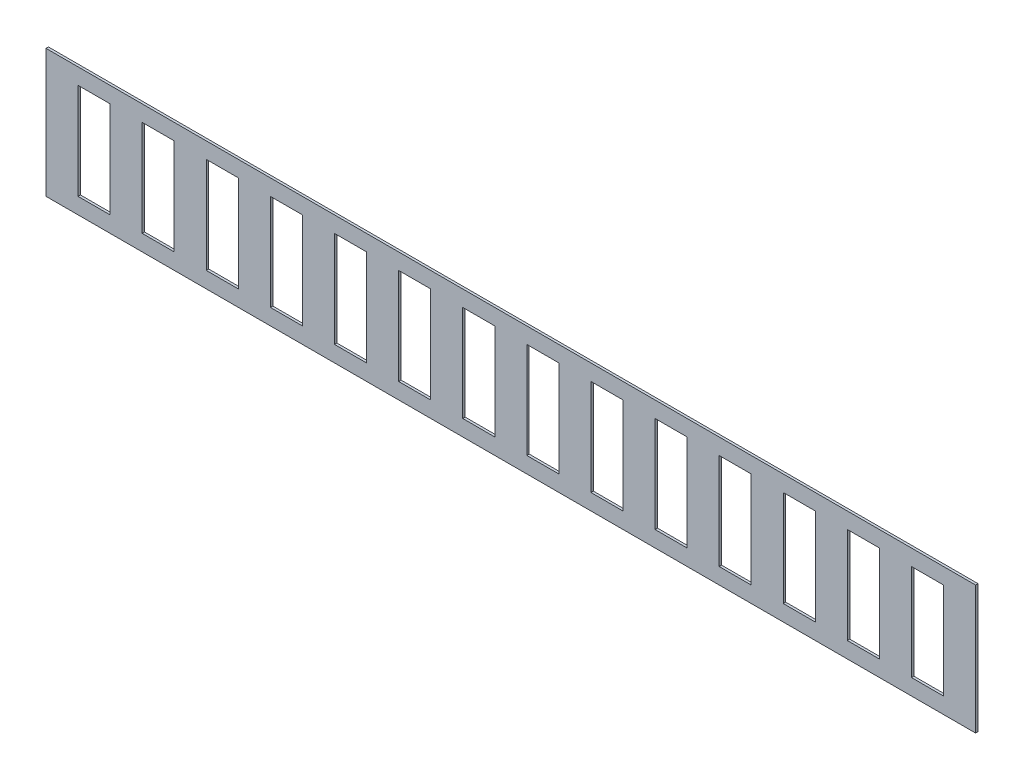
from build123d import *

# Parameters (mm, degrees)
PACK_PLINT_IZGARA_PANELI_1_START  = 18.5
SKETCH1_W                         = 580
SKETCH1_H                         = 80
PACK_PLINT_IZGARA_PANELI_1_DEPTH  = 1.5
PACK_PLINT_IZGARA_PANELI_2_START  = 17
SKETCH2_W                         = 20
SKETCH2_H                         = 60
PACK_PLINT_IZGARA_PANELI_2_DEPTH  = 4
PACK_PLINT_IZGARA_PANELI_3_START  = 17
SKETCH3_W                         = 20
SKETCH3_H                         = 60
PACK_PLINT_IZGARA_PANELI_3_DEPTH  = 4
PACK_PLINT_IZGARA_PANELI_4_START  = 17
SKETCH4_W                         = 20
SKETCH4_H                         = 60
PACK_PLINT_IZGARA_PANELI_4_DEPTH  = 4
PACK_PLINT_IZGARA_PANELI_5_START  = 17
SKETCH5_W                         = 20
SKETCH5_H                         = 60
PACK_PLINT_IZGARA_PANELI_5_DEPTH  = 4
PACK_PLINT_IZGARA_PANELI_6_START  = 17
SKETCH6_W                         = 20
SKETCH6_H                         = 60
PACK_PLINT_IZGARA_PANELI_6_DEPTH  = 4
PACK_PLINT_IZGARA_PANELI_7_START  = 17
SKETCH7_W                         = 20
SKETCH7_H                         = 60
PACK_PLINT_IZGARA_PANELI_7_DEPTH  = 4
PACK_PLINT_IZGARA_PANELI_8_START  = 17
SKETCH8_W                         = 20
SKETCH8_H                         = 60
PACK_PLINT_IZGARA_PANELI_8_DEPTH  = 4
PACK_PLINT_IZGARA_PANELI_9_START  = 17
SKETCH9_W                         = 20
SKETCH9_H                         = 60
PACK_PLINT_IZGARA_PANELI_9_DEPTH  = 4
PACK_PLINT_IZGARA_PANELI_10_START = 17
SKETCH10_W                        = 20
SKETCH10_H                        = 60
PACK_PLINT_IZGARA_PANELI_10_DEPTH = 4
PACK_PLINT_IZGARA_PANELI_11_START = 17
SKETCH11_W                        = 20
SKETCH11_H                        = 60
PACK_PLINT_IZGARA_PANELI_11_DEPTH = 4
PACK_PLINT_IZGARA_PANELI_12_START = 17
SKETCH12_W                        = 20
SKETCH12_H                        = 60
PACK_PLINT_IZGARA_PANELI_12_DEPTH = 4
PACK_PLINT_IZGARA_PANELI_13_START = 17
SKETCH13_W                        = 20
SKETCH13_H                        = 60
PACK_PLINT_IZGARA_PANELI_13_DEPTH = 4
PACK_PLINT_IZGARA_PANELI_14_START = 17
SKETCH14_W                        = 20
SKETCH14_H                        = 60
PACK_PLINT_IZGARA_PANELI_14_DEPTH = 4
PACK_PLINT_IZGARA_PANELI_15_START = 17
SKETCH15_W                        = 20
SKETCH15_H                        = 60
PACK_PLINT_IZGARA_PANELI_15_DEPTH = 4


with BuildPart() as part:
    # Sketch1 → PACK_plint_izgara_paneli_1 (new body)
    with BuildSketch(Plane.XY.offset(PACK_PLINT_IZGARA_PANELI_1_START)):
        with Locations((350, 70)):
            Rectangle(SKETCH1_W, SKETCH1_H)
    extrude(amount=PACK_PLINT_IZGARA_PANELI_1_DEPTH)

    # Sketch2 → PACK_plint_izgara_paneli_2 (cut)
    with BuildSketch(Plane.XY.offset(PACK_PLINT_IZGARA_PANELI_2_START)):
        with Locations((90, 70)):
            Rectangle(SKETCH2_W, SKETCH2_H)
    extrude(amount=PACK_PLINT_IZGARA_PANELI_2_DEPTH, mode=Mode.SUBTRACT)

    # Sketch3 → PACK_plint_izgara_paneli_3 (cut)
    with BuildSketch(Plane.XY.offset(PACK_PLINT_IZGARA_PANELI_3_START)):
        with Locations((130, 70)):
            Rectangle(SKETCH3_W, SKETCH3_H)
    extrude(amount=PACK_PLINT_IZGARA_PANELI_3_DEPTH, mode=Mode.SUBTRACT)

    # Sketch4 → PACK_plint_izgara_paneli_4 (cut)
    with BuildSketch(Plane.XY.offset(PACK_PLINT_IZGARA_PANELI_4_START)):
        with Locations((170, 70)):
            Rectangle(SKETCH4_W, SKETCH4_H)
    extrude(amount=PACK_PLINT_IZGARA_PANELI_4_DEPTH, mode=Mode.SUBTRACT)

    # Sketch5 → PACK_plint_izgara_paneli_5 (cut)
    with BuildSketch(Plane.XY.offset(PACK_PLINT_IZGARA_PANELI_5_START)):
        with Locations((210, 70)):
            Rectangle(SKETCH5_W, SKETCH5_H)
    extrude(amount=PACK_PLINT_IZGARA_PANELI_5_DEPTH, mode=Mode.SUBTRACT)

    # Sketch6 → PACK_plint_izgara_paneli_6 (cut)
    with BuildSketch(Plane.XY.offset(PACK_PLINT_IZGARA_PANELI_6_START)):
        with Locations((250, 70)):
            Rectangle(SKETCH6_W, SKETCH6_H)
    extrude(amount=PACK_PLINT_IZGARA_PANELI_6_DEPTH, mode=Mode.SUBTRACT)

    # Sketch7 → PACK_plint_izgara_paneli_7 (cut)
    with BuildSketch(Plane.XY.offset(PACK_PLINT_IZGARA_PANELI_7_START)):
        with Locations((290, 70)):
            Rectangle(SKETCH7_W, SKETCH7_H)
    extrude(amount=PACK_PLINT_IZGARA_PANELI_7_DEPTH, mode=Mode.SUBTRACT)

    # Sketch8 → PACK_plint_izgara_paneli_8 (cut)
    with BuildSketch(Plane.XY.offset(PACK_PLINT_IZGARA_PANELI_8_START)):
        with Locations((330, 70)):
            Rectangle(SKETCH8_W, SKETCH8_H)
    extrude(amount=PACK_PLINT_IZGARA_PANELI_8_DEPTH, mode=Mode.SUBTRACT)

    # Sketch9 → PACK_plint_izgara_paneli_9 (cut)
    with BuildSketch(Plane.XY.offset(PACK_PLINT_IZGARA_PANELI_9_START)):
        with Locations((370, 70)):
            Rectangle(SKETCH9_W, SKETCH9_H)
    extrude(amount=PACK_PLINT_IZGARA_PANELI_9_DEPTH, mode=Mode.SUBTRACT)

    # Sketch10 → PACK_plint_izgara_paneli_10 (cut)
    with BuildSketch(Plane.XY.offset(PACK_PLINT_IZGARA_PANELI_10_START)):
        with Locations((410, 70)):
            Rectangle(SKETCH10_W, SKETCH10_H)
    extrude(amount=PACK_PLINT_IZGARA_PANELI_10_DEPTH, mode=Mode.SUBTRACT)

    # Sketch11 → PACK_plint_izgara_paneli_11 (cut)
    with BuildSketch(Plane.XY.offset(PACK_PLINT_IZGARA_PANELI_11_START)):
        with Locations((450, 70)):
            Rectangle(SKETCH11_W, SKETCH11_H)
    extrude(amount=PACK_PLINT_IZGARA_PANELI_11_DEPTH, mode=Mode.SUBTRACT)

    # Sketch12 → PACK_plint_izgara_paneli_12 (cut)
    with BuildSketch(Plane.XY.offset(PACK_PLINT_IZGARA_PANELI_12_START)):
        with Locations((490, 70)):
            Rectangle(SKETCH12_W, SKETCH12_H)
    extrude(amount=PACK_PLINT_IZGARA_PANELI_12_DEPTH, mode=Mode.SUBTRACT)

    # Sketch13 → PACK_plint_izgara_paneli_13 (cut)
    with BuildSketch(Plane.XY.offset(PACK_PLINT_IZGARA_PANELI_13_START)):
        with Locations((530, 70)):
            Rectangle(SKETCH13_W, SKETCH13_H)
    extrude(amount=PACK_PLINT_IZGARA_PANELI_13_DEPTH, mode=Mode.SUBTRACT)

    # Sketch14 → PACK_plint_izgara_paneli_14 (cut)
    with BuildSketch(Plane.XY.offset(PACK_PLINT_IZGARA_PANELI_14_START)):
        with Locations((570, 70)):
            Rectangle(SKETCH14_W, SKETCH14_H)
    extrude(amount=PACK_PLINT_IZGARA_PANELI_14_DEPTH, mode=Mode.SUBTRACT)

    # Sketch15 → PACK_plint_izgara_paneli_15 (cut)
    with BuildSketch(Plane.XY.offset(PACK_PLINT_IZGARA_PANELI_15_START)):
        with Locations((610, 70)):
            Rectangle(SKETCH15_W, SKETCH15_H)
    extrude(amount=PACK_PLINT_IZGARA_PANELI_15_DEPTH, mode=Mode.SUBTRACT)


solid = part.part
